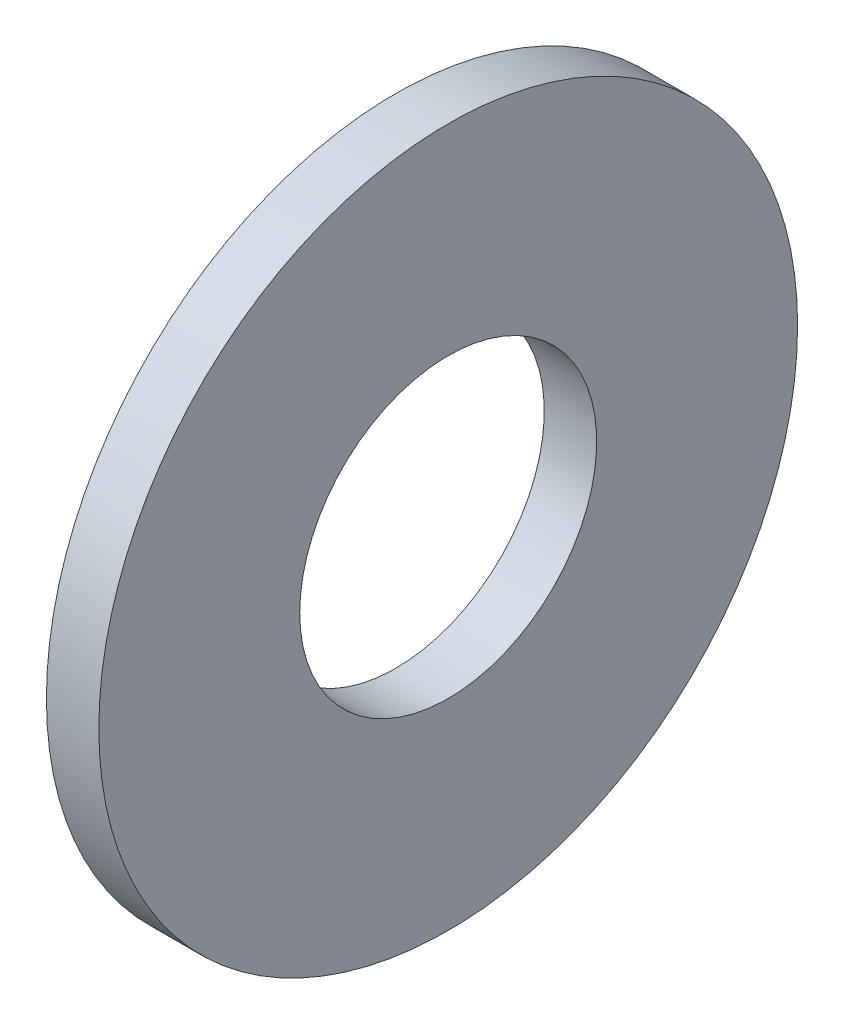
from build123d import *

# Parameters (mm, degrees)
SKETCH1_W = 0.3
SKETCH1_H = 1.15


with BuildPart() as part:
    # Sketch1 → Base-Revolve (revolve)
    with BuildSketch(Plane.XY, mode=Mode.PRIVATE) as base_revolve_sk:
        with Locations((-0.15, 1.425)):
            Rectangle(SKETCH1_W, SKETCH1_H)
    revolve(base_revolve_sk.sketch.rotate(Axis((-34.925, 0, 0), (1, 0, 0)), 90), axis=Axis((-34.925, 0, 0), (1, 0, 0)))


solid = part.part
